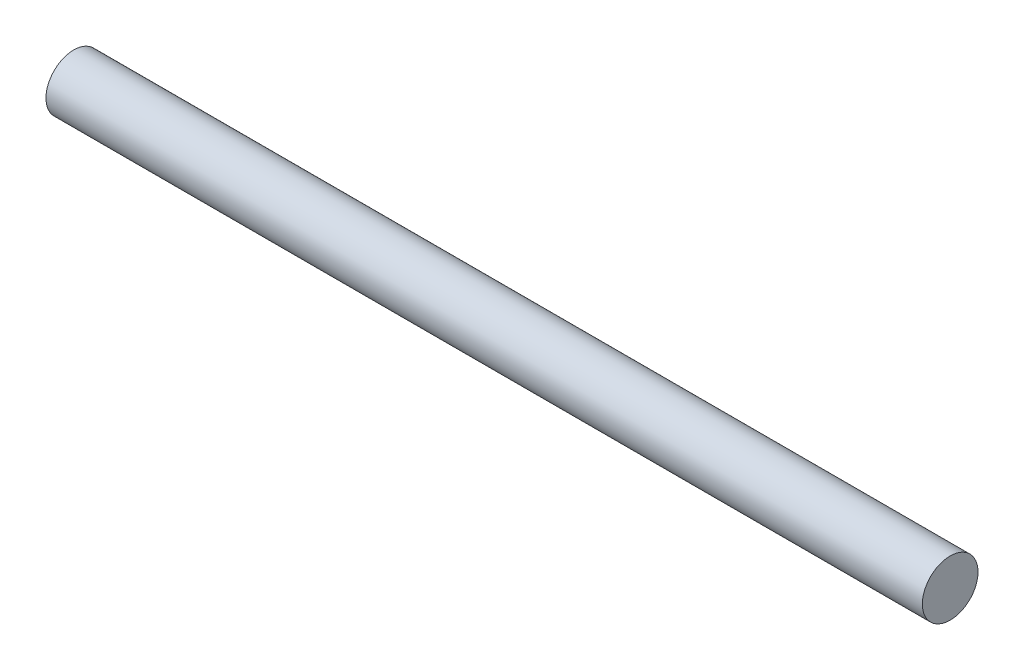
from build123d import *

# Parameters (mm, degrees)
SKETCH1_R           = 4.7625
BOSS_EXTRUDE1_DEPTH = 75


with BuildPart() as part:
    # Sketch1 → Boss-Extrude1 (new, symmetric)
    with BuildSketch(Plane(origin=(0, 0, 0), x_dir=(0, 0, -1), z_dir=(1, 0, 0))):
        Circle(SKETCH1_R)
    extrude(amount=BOSS_EXTRUDE1_DEPTH, both=True)


solid = part.part
